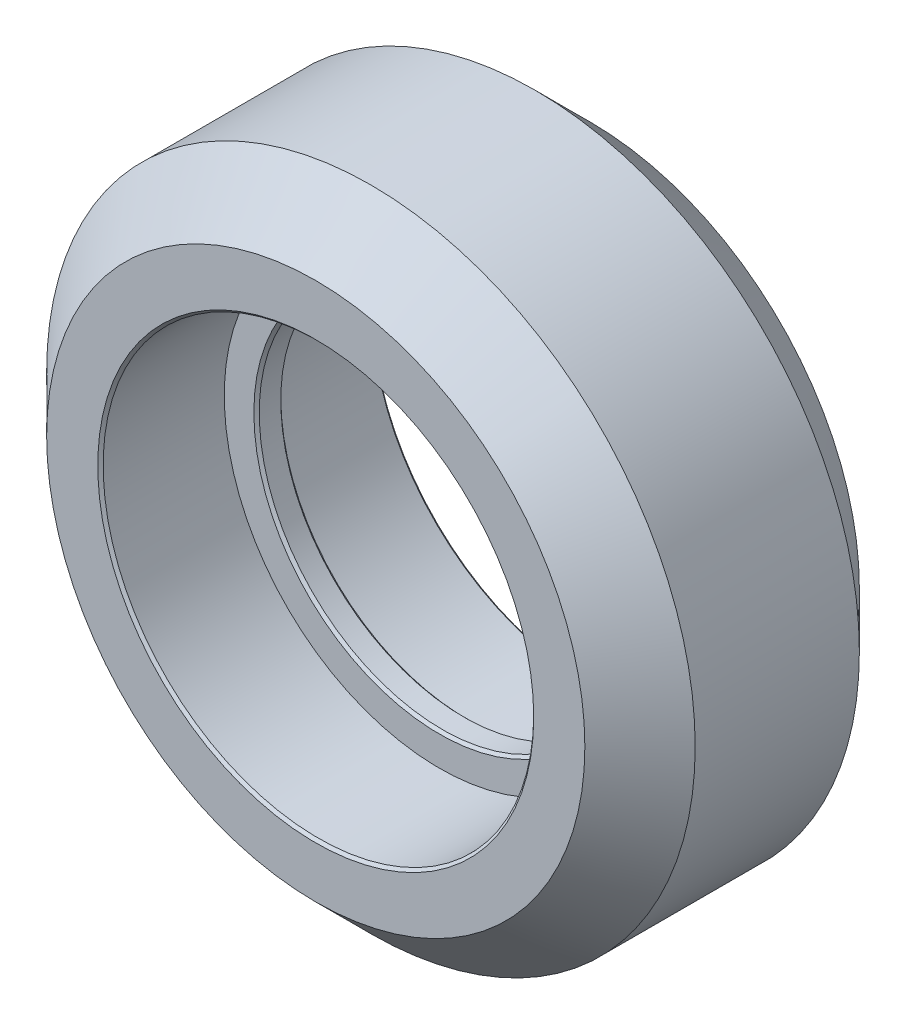
from build123d import *


with BuildPart() as part:
    # Croquis1 → Revolución1 (revolve)
    with BuildSketch(Plane(origin=(0, -35.5, 0), x_dir=(1, 0, 0), z_dir=(0, 1, 0))):
        Polygon((22.4, 13.95), (22.3, 13.85), (22.3, 13.05), (22.4, 12.95), (23.5, 12.95), (23.5, 8.45), (23.6, 8.35), (25.5, 8.35), (27.55, 10.4), (27.55, 16.5), (25.5, 18.55), (23.6, 18.55), (23.5, 18.45), (23.5, 13.95), align=None)
    revolve(axis=Axis((15.5, -35.5, -18.55), (0, 0, 1)))


solid = part.part
